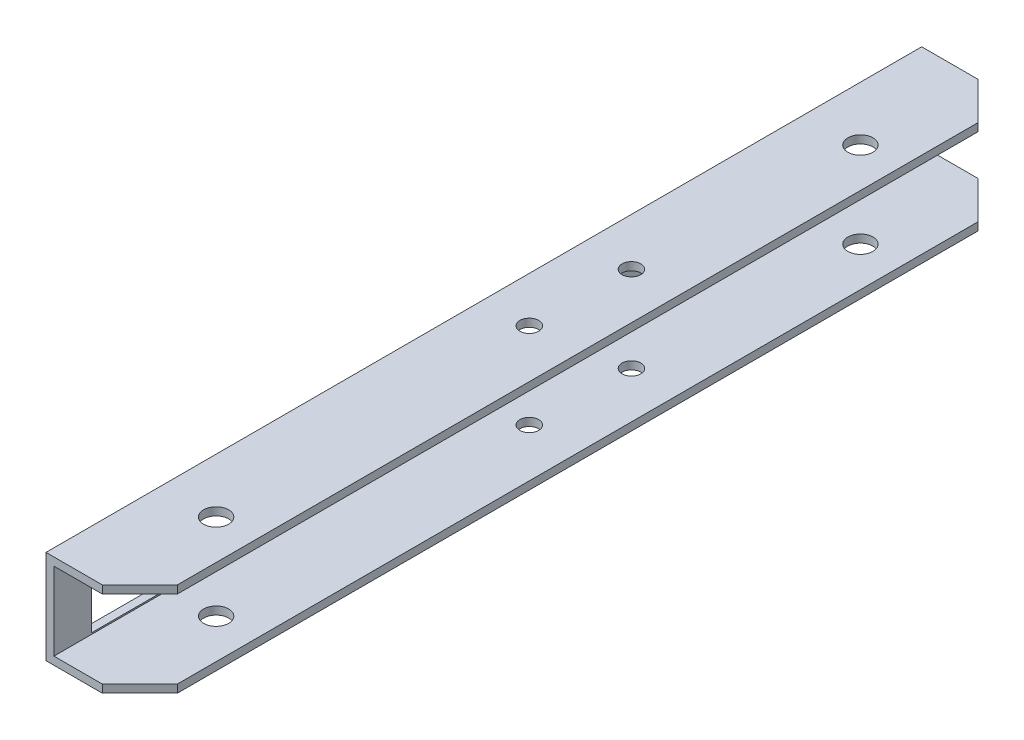
from build123d import *

# Parameters (mm, degrees)
BOSS_EXTRUDE1_DEPTH = 700
SKETCH3_W           = 125
SKETCH3_H           = 60
CUT_EXTRUDE1_DEPTH  = 706.00443261
CHAMFER1_SIZE       = 30
SKETCH4_R           = 10
CUT_EXTRUDE2_DEPTH  = 708.990112925
SKETCH5_R           = 7.5
CUT_EXTRUDE3_DEPTH  = 708.990112925
CHAMFER2_SIZE       = 3
FILLET1_R           = 3


with BuildPart() as part:
    # Sketch1 → Boss-Extrude1 (new body)
    with BuildSketch(Plane.XY):
        Polygon((0, -37.5), (0, 37.5), (75, 37.5), (75, 31.15), (6.35, 31.15), (6.35, -31.15), (75, -31.15), (75, -37.5), align=None)
    extrude(amount=BOSS_EXTRUDE1_DEPTH)

    # Sketch3 → Cut-Extrude1 (cut, through all)
    with BuildSketch(Plane.ZY):
        with Locations((92.5, 0)):
            Rectangle(SKETCH3_W, SKETCH3_H)
        with Locations((607.5, 0)):
            Rectangle(SKETCH3_W, SKETCH3_H)
        Polygon((400, 10.383333333), (373, 10.383333333), (373, 31.15), (327, 31.15), (307, 31.15), (307, 10.383333333), (300, 10.383333333), (270, 10.383333333), (270, -10.383333333), (300, -10.383333333), (327, -10.383333333), (327, -31.15), (373, -31.15), (393, -31.15), (393, -10.383333333), (400, -10.383333333), align=None)
    extrude(amount=-CUT_EXTRUDE1_DEPTH, mode=Mode.SUBTRACT)

    # Chamfer1
    chamfer1_edges = [part.edges().sort_by_distance(p)[0] for p in [
        (75, -34.325, 0),
        (75, 34.325, 700),
        (75, -34.325, 700),
        (75, 34.325, 0),
    ]]
    chamfer(chamfer1_edges, length=CHAMFER1_SIZE)

    # Sketch4 → Cut-Extrude2 (cut, through all)
    with BuildSketch(Plane(origin=(0, 37.5, 0), x_dir=(1, 0, 0), z_dir=(0, 1, 0))):
        with Locations(Location((43.5, -607.5, 0), (0, 0, 270))):
            Circle(SKETCH4_R)
        with Locations(Location((43.5, -92.5, 0), (0, 0, 270))):
            Circle(SKETCH4_R)
    extrude(amount=-CUT_EXTRUDE2_DEPTH, mode=Mode.SUBTRACT)

    # Sketch5 → Cut-Extrude3 (cut, through all)
    with BuildSketch(Plane.XZ.offset(37.5)):
        with Locations(Location((38, 270.017579968, 0), (0, 0, 270))):
            Circle(SKETCH5_R)
        with Locations(Location((36.322953254, 350, 0), (0, 0, 270))):
            Circle(SKETCH5_R)
    extrude(amount=-CUT_EXTRUDE3_DEPTH, mode=Mode.SUBTRACT)

    # Chamfer2
    chamfer2_edges = [part.edges().sort_by_distance(p)[0] for p in [
        (6.35, 0, 155),
        (6.35, 0, 545),
        (6.35, -20.766666667, 327),
        (6.35, 0, 270),
        (6.35, 20.766666667, 373),
        (0, -20.766666667, 393),
        (0, 20.766666667, 307),
    ]]
    chamfer(chamfer2_edges, length=CHAMFER2_SIZE)

    # Fillet1
    fillet1_edges = [part.edges().sort_by_distance(p)[0] for p in [
        (1.675, 10.383333333, 270),
        (1.675, -10.383333333, 270),
        (1.675, 31.15, 373),
        (1.675, -31.15, 327),
        (4.675, -31.15, 393),
        (4.675, 31.15, 307),
        (3.175, 10.383333333, 400),
        (3.175, -10.383333333, 400),
    ]]
    fillet(fillet1_edges, radius=FILLET1_R)


solid = part.part
